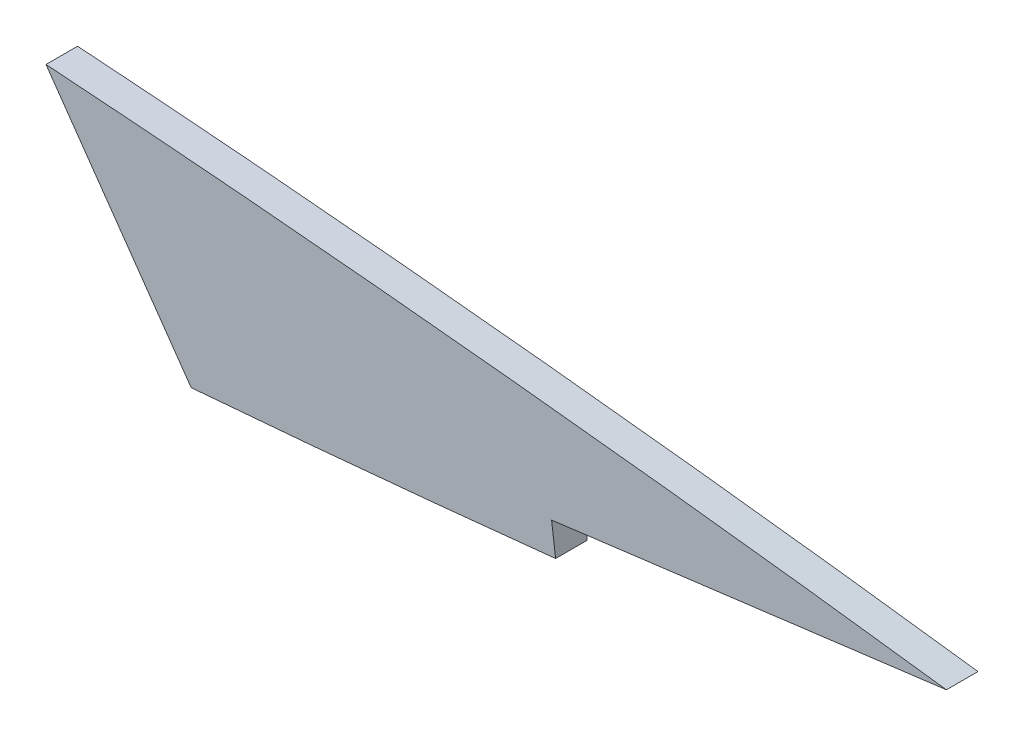
from build123d import *

# Parameters (mm, degrees)
BOSS_EXTRUDE1_DEPTH = 3.175
CUT_EXTRUDE1_DEPTH  = 5.08


with BuildPart() as part:
    # Sketch2 → Boss-Extrude1 (new body)
    with BuildSketch(Plane.XY):
        with BuildLine():
            add(Edge.make_bspline(
                [(213.36, 0), (213.257272793, 0.119144956), (212.930217359, 0.49847003), (211.784320833, 0.388103102), (210.220456583, 0.752231195), (207.922221089, 1.002358459), (205.040435451, 1.416814194), (201.53687476, 1.872417288), (197.453852985, 2.405608245), (192.809425036, 2.993232985), (187.634552437, 3.632300405), (181.96038472, 4.311820743), (175.822180186, 5.024095776), (169.257621951, 5.759205624), (162.307240439, 6.508241756), (155.013925984, 7.261881453), (147.42262952, 8.010402764), (139.580173762, 8.743297071), (131.534856191, 9.450943444), (123.336366748, 10.121511173), (115.035081585, 10.744066661), (106.682256297, 11.307051658), (98.329355975, 11.798694638), (90.027802971, 12.206574858), (81.828867412, 12.519815813), (73.782861936, 12.728198408), (65.939509207, 12.821544448), (58.347003411, 12.792445951), (51.052154229, 12.635282307), (44.099865123, 12.34606959), (37.532927606, 11.924051264), (31.391706263, 11.370497155), (25.713767757, 10.689730544), (20.533764615, 9.887543747), (15.882945038, 8.97231492), (11.789015751, 7.954392799), (8.273858988, 6.843703394), (5.359469774, 5.650591236), (3.043164975, 4.383128287), (1.36213983, 3.038812968), (0.222897845, 1.585123236), (0.070856618, 0.503892135), (0, 0)],
                knots=[0, 0, 0, 0, 0.002091853, 0.006659889, 0.014240034, 0.024784942, 0.038226646, 0.054481348, 0.073444809, 0.094998776, 0.11900639, 0.145318898, 0.173770288, 0.204183654, 0.236370679, 0.270129473, 0.305250351, 0.341516861, 0.378701149, 0.416575318, 0.454902219, 0.493447217, 0.531971459, 0.57023708, 0.608012632, 0.645066312, 0.681178002, 0.716129843, 0.74971807, 0.781748295, 0.812036536, 0.840415327, 0.866732056, 0.890849065, 0.912651845, 0.932046273, 0.94897292, 0.963413199, 0.975421325, 0.985175212, 0.993091122, 1, 1, 1, 1], degree=3))
            add(Edge.make_bspline(
                [(213.36, 0), (213.257272793, -0.119144956), (212.930217359, -0.49847003), (211.784320833, -0.388103102), (210.220456583, -0.752231195), (207.922221089, -1.002358459), (205.040435451, -1.416814194), (201.53687476, -1.872417288), (197.453852985, -2.405608245), (192.809425036, -2.993232985), (187.634552437, -3.632300405), (181.96038472, -4.311820743), (175.822180186, -5.024095776), (169.257621951, -5.759205624), (162.307240439, -6.508241756), (155.013925984, -7.261881453), (147.42262952, -8.010402764), (139.580173762, -8.743297071), (131.534856191, -9.450943444), (123.336366748, -10.121511173), (115.035081585, -10.744066661), (106.682256297, -11.307051658), (98.329355975, -11.798694638), (90.027802971, -12.206574858), (81.828867412, -12.519815813), (73.782861936, -12.728198408), (65.939509207, -12.821544448), (58.347003411, -12.792445951), (51.052154229, -12.635282307), (44.099865123, -12.34606959), (37.532927606, -11.924051264), (31.391706263, -11.370497155), (25.713767757, -10.689730544), (20.533764615, -9.887543747), (15.882945038, -8.97231492), (11.789015751, -7.954392799), (8.273858988, -6.843703394), (5.359469774, -5.650591236), (3.043164975, -4.383128287), (1.36213983, -3.038812968), (0.222897845, -1.585123236), (0.070856618, -0.503892135), (0, 0)],
                knots=[0, 0, 0, 0, 0.002091853, 0.006659889, 0.014240034, 0.024784942, 0.038226646, 0.054481348, 0.073444809, 0.094998776, 0.11900639, 0.145318898, 0.173770288, 0.204183654, 0.236370679, 0.270129473, 0.305250351, 0.341516861, 0.378701149, 0.416575318, 0.454902219, 0.493447217, 0.531971459, 0.57023708, 0.608012632, 0.645066312, 0.681178002, 0.716129843, 0.74971807, 0.781748295, 0.812036536, 0.840415327, 0.866732056, 0.890849065, 0.912651845, 0.932046273, 0.94897292, 0.963413199, 0.975421325, 0.985175212, 0.993091122, 1, 1, 1, 1], degree=3))
        make_face()
    extrude(amount=BOSS_EXTRUDE1_DEPTH)

    # Sketch3 → Cut-Extrude1 (cut)
    with BuildSketch(Plane.XY.offset(3.175)):
        Polygon((111.76, 10.961711107), (126.348178921, -9.872367542), (126.348178921, -50.8), (0, -50.8), (0, 0), (0, 50.8), (111.76, 50.8), align=None)
        Polygon((163.371025422, -9.582434223), (213.762062152, -3.149439796), (212.957937848, 3.149439796), (162.566901119, -3.283554632), align=None)
    extrude(amount=-CUT_EXTRUDE1_DEPTH, mode=Mode.SUBTRACT)


solid = part.part
